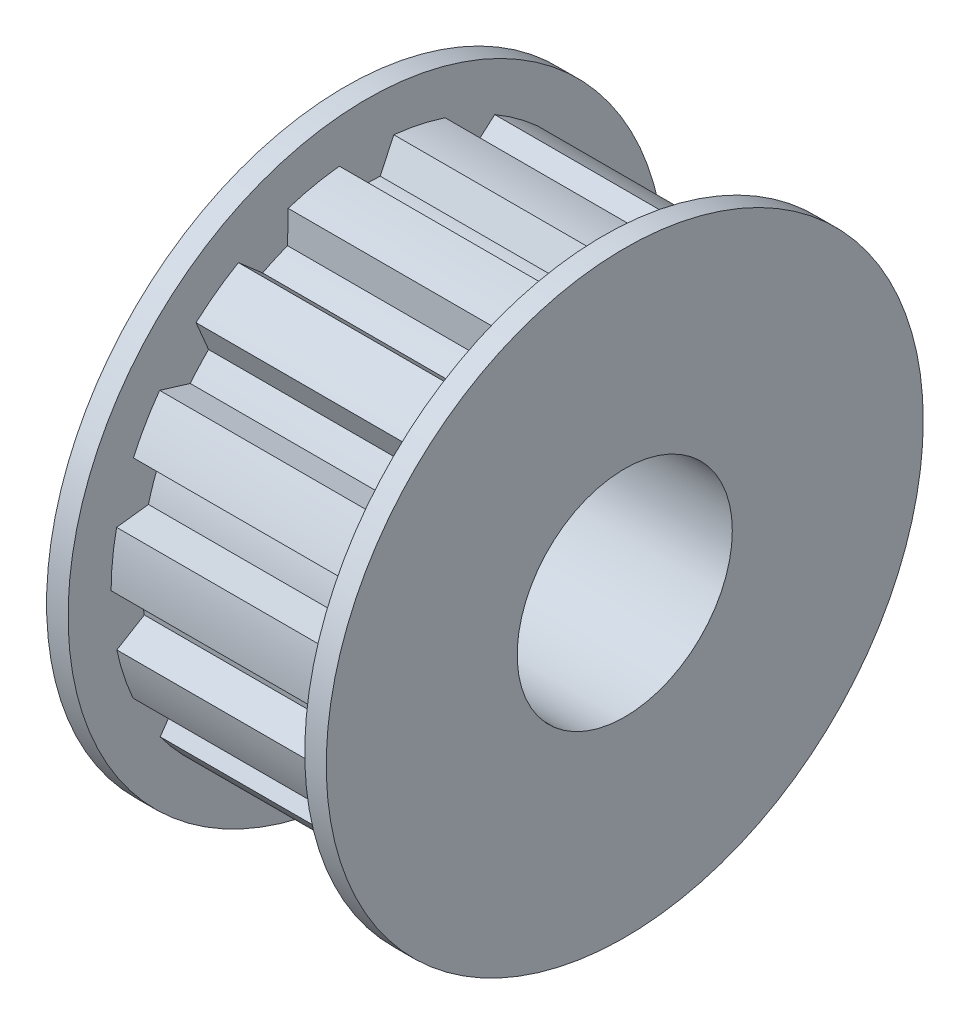
from build123d import *

# Parameters (mm, degrees)
SKETCH1_R           = 11.875
SKETCH1_R_2         = 5
BOSS_EXTRUDE1_DEPTH = 11
CUT_EXTRUDE1_DEPTH  = 21.075638221
SKETCH4_R           = 13.875
SKETCH4_R_2         = 5
BOSS_EXTRUDE2_DEPTH = 1
LPATTERN1_COUNT     = 2
LPATTERN1_PITCH     = 12


with BuildPart() as part:
    # Sketch1 → Boss-Extrude1 (new body)
    with BuildSketch(Plane(origin=(0, 0, 0), x_dir=(0, 0, -1), z_dir=(1, 0, 0))):
        Circle(SKETCH1_R)
        Circle(SKETCH1_R_2, mode=Mode.SUBTRACT)
    extrude(amount=BOSS_EXTRUDE1_DEPTH)

    # Sketch2 → Cut-Extrude1 (cut, through all)
    with BuildSketch(Plane.ZY):
        with BuildLine():
            Line((1.26491017, 11.807439488), (0.63461115, 10.455758877))
            ThreePointArc((0.63461115, 10.455758877), (0, 10.475), (-0.63461115, 10.455758877))
            Line((-0.63461115, 10.455758877), (-1.26491017, 11.807439488))
            ThreePointArc((-1.26491017, 11.807439488), (0, 11.875), (1.26491017, 11.807439488))
        make_face()
        with BuildLine():
            Line((5.958071241, 10.272147394), (4.8324864, 9.293691419))
            ThreePointArc((4.8324864, 9.293691419), (4.260566336, 9.569388669), (3.672994133, 9.809930637))
            Line((3.672994133, 9.809930637), (3.64696536, 11.301118027))
            ThreePointArc((3.64696536, 11.301118027), (4.829997637, 10.84835231), (5.958071241, 10.272147394))
        make_face()
        with BuildLine():
            Line((9.621027667, 6.960707696), (8.194780849, 6.524660285))
            ThreePointArc((8.194780849, 6.524660285), (7.784442047, 7.009143102), (7.345505362, 7.467876269))
            Line((7.345505362, 7.467876269), (7.928247448, 8.840730592))
            ThreePointArc((7.928247448, 8.840730592), (8.824844803, 7.945925951), (9.621027667, 6.960707696))
        make_face()
        with BuildLine():
            Line((11.620421005, 2.445698402), (10.140123243, 2.627456112))
            ThreePointArc((10.140123243, 2.627456112), (9.962317008, 3.236953016), (9.747911982, 3.834558252))
            Line((9.747911982, 3.834558252), (10.838663527, 4.851700522))
            ThreePointArc((10.838663527, 4.851700522), (11.293796131, 3.669576808), (11.620421005, 2.445698402))
        make_face()
        with BuildLine():
            Line((11.610537983, -2.492194365), (10.332146207, -1.724059091))
            ThreePointArc((10.332146207, -1.724059091), (10.417616854, -1.094935653), (10.464816064, -0.461789724))
            Line((10.464816064, -0.461789724), (11.874976215, 0.023767355))
            ThreePointArc((11.874976215, 0.023767355), (11.809947507, -1.241275501), (11.610537983, -2.492194365))
        make_face()
        with BuildLine():
            Line((9.593087465, -6.999164085), (8.737647228, -5.777468816))
            ThreePointArc((8.737647228, -5.777468816), (9.071616105, -5.2375), (9.372258378, -4.678290061))
            Line((9.372258378, -4.678290061), (10.857997635, -4.808275403))
            ThreePointArc((10.857997635, -4.808275403), (10.28405167, -5.9375), (9.593087465, -6.999164085))
        make_face()
        with BuildLine():
            Line((5.916904974, -10.295914749), (5.632329664, -8.831901695))
            ThreePointArc((5.632329664, -8.831901695), (6.157050518, -8.474453016), (6.659152074, -8.085871545))
            Line((6.659152074, -8.085871545), (7.963572623, -8.808923662))
            ThreePointArc((7.963572623, -8.808923662), (6.979949871, -9.607076808), (5.916904974, -10.295914749))
        make_face()
        with BuildLine():
            Line((1.21763586, -11.812408218), (1.553131133, -10.359218536))
            ThreePointArc((1.553131133, -10.359218536), (2.177874961, -10.246096118), (2.794617881, -10.095332382))
            Line((2.794617881, -10.095332382), (3.692173556, -11.286428994))
            ThreePointArc((3.692173556, -11.286428994), (2.468951328, -11.615502759), (1.21763586, -11.812408218))
        make_face()
        with BuildLine():
            Line((-3.692173556, -11.286428994), (-2.794617881, -10.095332382))
            ThreePointArc((-2.794617881, -10.095332382), (-2.177874961, -10.246096118), (-1.553131133, -10.359218536))
            Line((-1.553131133, -10.359218536), (-1.21763586, -11.812408218))
            ThreePointArc((-1.21763586, -11.812408218), (-2.468951328, -11.615502759), (-3.692173556, -11.286428994))
        make_face()
        with BuildLine():
            Line((-7.963572623, -8.808923662), (-6.659152074, -8.085871545))
            ThreePointArc((-6.659152074, -8.085871545), (-6.157050518, -8.474453016), (-5.632329664, -8.831901695))
            Line((-5.632329664, -8.831901695), (-5.916904974, -10.295914749))
            ThreePointArc((-5.916904974, -10.295914749), (-6.979949871, -9.607076808), (-7.963572623, -8.808923662))
        make_face()
        with BuildLine():
            Line((-10.857997635, -4.808275403), (-9.372258378, -4.678290061))
            ThreePointArc((-9.372258378, -4.678290061), (-9.071616105, -5.2375), (-8.737647228, -5.777468816))
            Line((-8.737647228, -5.777468816), (-9.593087465, -6.999164085))
            ThreePointArc((-9.593087465, -6.999164085), (-10.28405167, -5.9375), (-10.857997635, -4.808275403))
        make_face()
        with BuildLine():
            Line((-11.874976215, 0.023767355), (-10.464816064, -0.461789724))
            ThreePointArc((-10.464816064, -0.461789724), (-10.417616854, -1.094935653), (-10.332146207, -1.724059091))
            Line((-10.332146207, -1.724059091), (-11.610537983, -2.492194365))
            ThreePointArc((-11.610537983, -2.492194365), (-11.809947507, -1.241275501), (-11.874976215, 0.023767355))
        make_face()
        with BuildLine():
            Line((-10.838663527, 4.851700522), (-9.747911982, 3.834558252))
            ThreePointArc((-9.747911982, 3.834558252), (-9.962317008, 3.236953016), (-10.140123243, 2.627456112))
            Line((-10.140123243, 2.627456112), (-11.620421005, 2.445698402))
            ThreePointArc((-11.620421005, 2.445698402), (-11.293796131, 3.669576808), (-10.838663527, 4.851700522))
        make_face()
        with BuildLine():
            Line((-7.928247448, 8.840730592), (-7.345505362, 7.467876269))
            ThreePointArc((-7.345505362, 7.467876269), (-7.784442047, 7.009143102), (-8.194780849, 6.524660285))
            Line((-8.194780849, 6.524660285), (-9.621027667, 6.960707696))
            ThreePointArc((-9.621027667, 6.960707696), (-8.824844803, 7.945925951), (-7.928247448, 8.840730592))
        make_face()
        with BuildLine():
            Line((-3.64696536, 11.301118027), (-3.672994133, 9.809930637))
            ThreePointArc((-3.672994133, 9.809930637), (-4.260566336, 9.569388669), (-4.8324864, 9.293691419))
            Line((-4.8324864, 9.293691419), (-5.958071241, 10.272147394))
            ThreePointArc((-5.958071241, 10.272147394), (-4.829997637, 10.84835231), (-3.64696536, 11.301118027))
        make_face()
    extrude(amount=-CUT_EXTRUDE1_DEPTH, mode=Mode.SUBTRACT)

    # Sketch4 → Boss-Extrude2 (add)
    with BuildSketch(Plane(origin=(11, 0, 0), x_dir=(0, 0, -1), z_dir=(1, 0, 0))):
        Circle(SKETCH4_R)
        Circle(SKETCH4_R_2, mode=Mode.SUBTRACT)
    boss_extrude2 = extrude(amount=BOSS_EXTRUDE2_DEPTH)

    # LPattern1: Boss-Extrude2 ×2
    with Locations(*[(-i * LPATTERN1_PITCH, 0, 0) for i in range(1, LPATTERN1_COUNT)]):
        add(boss_extrude2)


solid = part.part
